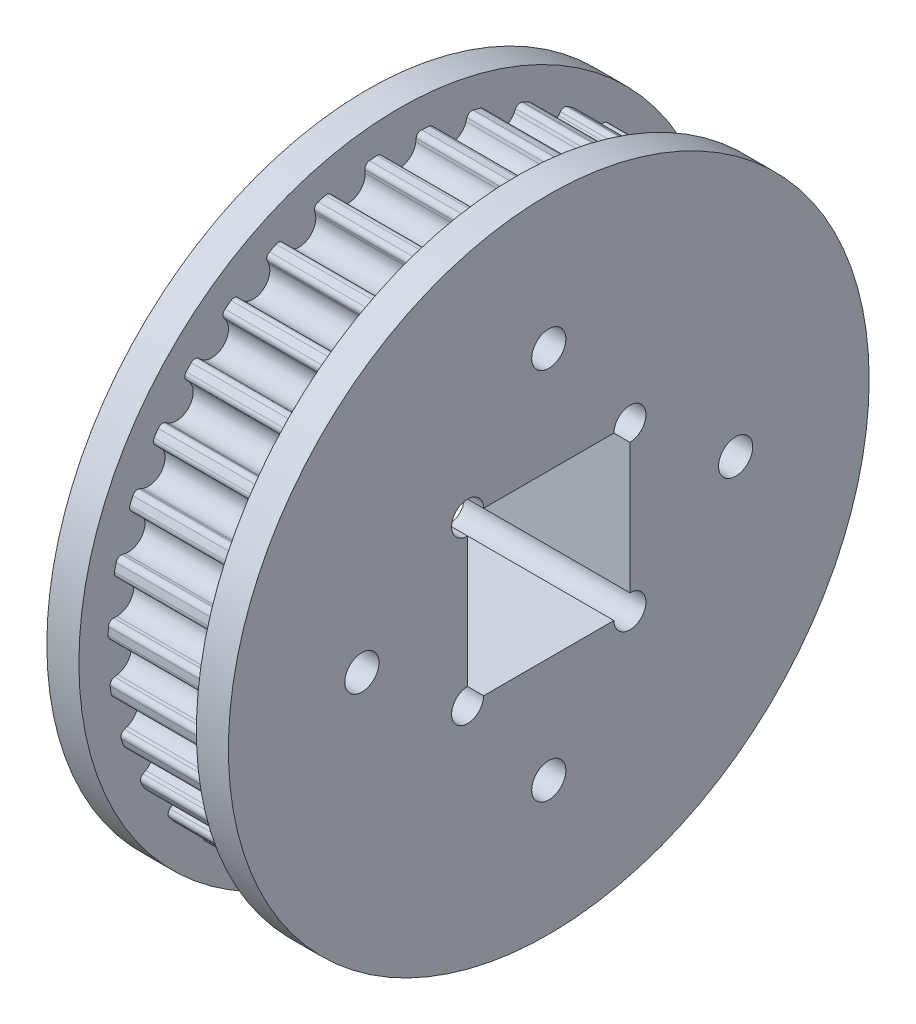
from build123d import *

# Parameters (mm, degrees)
CHAMFER_1_SIZE           = 1
SKETCH_4_W               = 5
SKETCH_4_H               = 2.299999953
CUT_EXTRUDE_1_DEPTH      = 48.667374251
CUT_EXTRUDE_2_REACH      = 49.667
PATTERN_CIRCULAR_3_COUNT = 35
SKETCH_8_R               = 30
CUT_EXTRUDE_3_DEPTH      = 17
SKETCH_9_R               = 30
EXTRUDE_1_DEPTH          = 3
EXTRUDE_START            = 3
SKETCH_10_R              = 30
EXTRUDE_2_DEPTH          = 3
SKETCH_12_R              = 18.838025557
EXTRUDE_3_DEPTH          = 17
SKETCH_11_W              = 15.2
SKETCH_11_H              = 15.2
CUT_EXTRUDE_4_DEPTH      = 46.705579528
SKETCH_14_R              = 1.6
CUT_EXTRUDE_5_DEPTH      = 46.705579528
SKETCH_15_R              = 1.5
CUT_EXTRUDE_6_DEPTH      = 46.705579528


with BuildPart() as part:
    # 草图1 → 旋转1 (revolve)
    with BuildSketch(Plane.XY, mode=Mode.PRIVATE) as revolve_1_sk:
        Polygon((0, 6.2516), (0, 27.278), (28, 27.278), (28, 12.5032), (20, 12.5032), (20, 6.2516), align=None)
    revolve(revolve_1_sk.sketch.rotate(Axis((0, 0, 0), (1, 0, 0)), 90), axis=Axis((0, 0, 0), (1, 0, 0)))

    # 倒角1
    chamfer_1_edges = [part.edges().sort_by_distance(p)[0] for p in [
        (20, 0, -6.2516),
        (0, 0, -6.2516),
    ]]
    chamfer(chamfer_1_edges, length=CHAMFER_1_SIZE)

    # 草图4 → 切除-拉伸1 (cut, through all)
    with BuildSketch(Plane.ZY):
        with Locations((0, 6.879965295)):
            Rectangle(SKETCH_4_W, SKETCH_4_H)
    extrude(amount=-CUT_EXTRUDE_1_DEPTH, mode=Mode.SUBTRACT)

    # 草图6 → 切除-拉伸2 (cut, up to next)
    with BuildSketch(Plane(origin=(0, 0, 0), x_dir=(0, 0, -1), z_dir=(1, 0, 0)), mode=Mode.PRIVATE) as cut_extrude_2_sk1:
        with BuildLine():
            Line((1.583892871, 26.777178128), (1.548371997, 26.487883824))
            ThreePointArc((1.548371997, 26.487883824), (0, 25.118), (-1.548371997, 26.487883824))
            Line((-1.548371997, 26.487883824), (-1.583892871, 26.777178128))
            ThreePointArc((-1.583892871, 26.777178128), (-1.756322779, 27.090149167), (-2.097218942, 27.197260096))
            ThreePointArc((-2.097218942, 27.197260096), (-2.336427394, 27.177755445), (-2.575454979, 27.156146922))
            Line((-2.575454979, 27.156146922), (-2.772102967, 28.757716264))
            ThreePointArc((-2.772102967, 28.757716264), (0, 28.891015898), (2.772102967, 28.757716264))
            Line((2.772102967, 28.757716264), (2.575454979, 27.156146922))
            ThreePointArc((2.575454979, 27.156146922), (2.336427394, 27.177755445), (2.097218942, 27.197260096))
            ThreePointArc((2.097218942, 27.197260096), (1.756322779, 27.090149167), (1.583892871, 26.777178128))
        make_face()
    cut_extrude_2_tool1 = extrude(cut_extrude_2_sk1.sketch, amount=CUT_EXTRUDE_2_REACH, mode=Mode.PRIVATE) & part.part
    cut_extrude_2 = cut_extrude_2_tool1.solids().sort_by_distance((0, 27.366169, 0))[0]
    add(cut_extrude_2, mode=Mode.SUBTRACT)

    # 阵列(圆周)3: 切除-拉伸2 ×35 about axis
    pattern_circular_3_axis = Axis((0, 0, 0), (1, 0, 0))
    for i in range(1, PATTERN_CIRCULAR_3_COUNT):
        add(cut_extrude_2.rotate(pattern_circular_3_axis, i * 360 / PATTERN_CIRCULAR_3_COUNT), mode=Mode.SUBTRACT)

    # 草图8 → 切除-拉伸3 (cut)
    with BuildSketch(Plane(origin=(28, 0, 0), x_dir=(0, 0, -1), z_dir=(1, 0, 0))):
        Circle(SKETCH_8_R)
    extrude(amount=-CUT_EXTRUDE_3_DEPTH, mode=Mode.SUBTRACT)

    # 草图9 → 凸台-拉伸1 (add)
    with BuildSketch(Plane(origin=(11, 0, 0), x_dir=(0, 0, -1), z_dir=(1, 0, 0))):
        Circle(SKETCH_9_R)
    extrude(amount=EXTRUDE_1_DEPTH)

    # 草图10 → 凸台-拉伸2 (add)
    with BuildSketch(Plane.ZY.offset(EXTRUDE_START)):
        with Locations(Location((0, 0, 0), (0, 0, 180))):
            Circle(SKETCH_10_R)
    extrude(amount=-EXTRUDE_2_DEPTH)

    # 草图12 → 凸台-拉伸3 (add)
    with BuildSketch(Plane.ZY.offset(3)):
        Circle(SKETCH_12_R)
    extrude(amount=-EXTRUDE_3_DEPTH)

    # 草图11 → 切除-拉伸4 (cut, through all)
    with BuildSketch(Plane.ZY.offset(3)):
        Rectangle(SKETCH_11_W, SKETCH_11_H)
    extrude(amount=-CUT_EXTRUDE_4_DEPTH, mode=Mode.SUBTRACT)

    # 草图14 → 切除-拉伸5 (cut, through all)
    with BuildSketch(Plane.ZY.offset(3)):
        with Locations((0, 17.5)):
            Circle(SKETCH_14_R)
        with Locations((17.5, 0)):
            Circle(SKETCH_14_R)
        with Locations((0, -17.5)):
            Circle(SKETCH_14_R)
        with Locations((-17.5, 0)):
            Circle(SKETCH_14_R)
    extrude(amount=-CUT_EXTRUDE_5_DEPTH, mode=Mode.SUBTRACT)

    # 草图15 → 切除-拉伸6 (cut, through all)
    with BuildSketch(Plane.ZY.offset(3)):
        with Locations((-7.6, 7.6)):
            Circle(SKETCH_15_R)
        with Locations((7.6, 7.6)):
            Circle(SKETCH_15_R)
        with Locations((7.6, -7.6)):
            Circle(SKETCH_15_R)
        with Locations((-7.6, -7.6)):
            Circle(SKETCH_15_R)
    extrude(amount=-CUT_EXTRUDE_6_DEPTH, mode=Mode.SUBTRACT)


solid = part.part
